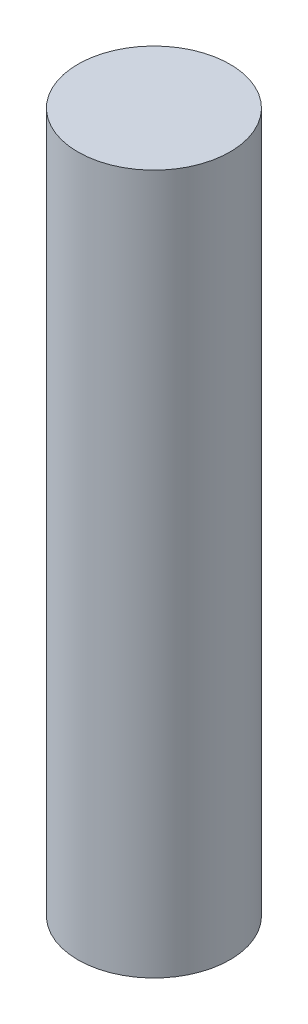
from build123d import *

# Parameters (mm, degrees)
SKETCH_1_R      = 5
EXTRUDE_3_DEPTH = 46


with BuildPart() as part:
    # 草图1 → 凸台-拉伸3 (new body)
    with BuildSketch(Plane(origin=(0, 0, 0), x_dir=(1, 0, 0), z_dir=(0, 1, 0))):
        with Locations(Location((0, 0, 0), (0, 0, 270))):
            Circle(SKETCH_1_R)
    extrude(amount=EXTRUDE_3_DEPTH)


solid = part.part
